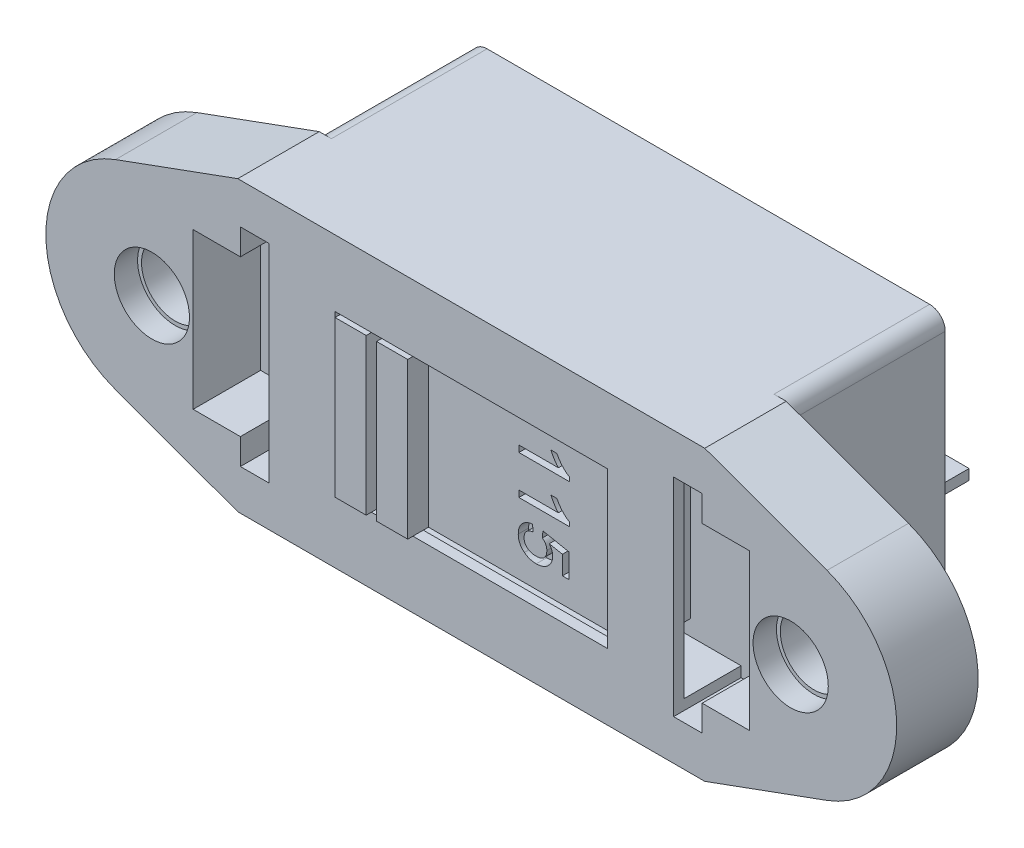
from build123d import *

# Parameters (mm, degrees)
SKETCH1_R           = 1.651
BASE_EXTRUDE_DEPTH  = 3.9878
SKETCH2_R           = 1.8415
CUT_EXTRUDE1_DEPTH  = 1.143
SKETCH3_W           = 13.335
SKETCH3_H           = 7.62
CUT_EXTRUDE2_DEPTH  = 3.302
CUT_EXTRUDE3_REACH  = 33.786
SKETCH4_W           = 0.508
SKETCH4_H           = 9.144
SKETCH4_W_2         = 2.286
BOSS_EXTRUDE1_DEPTH = 7.62
SKETCH6_W           = 21.6662
SKETCH6_H           = 12.5984
CUT_EXTRUDE4_DEPTH  = 1.524
SKETCH7_W           = 17.3355
SKETCH7_H           = 7.62
BOSS_EXTRUDE7_DEPTH = 2.54
SKETCH8_W           = 1.524
SKETCH8_H           = 7.62
BOSS_EXTRUDE8_DEPTH = 1.016
CUT_EXTRUDE5_DEPTH  = 0.508
SKETCH11_W          = 3.81
SKETCH11_H          = 0.508
BOSS_EXTRUDE9_DEPTH = 6.35
CUT_EXTRUDE6_DEPTH  = 1.27


with BuildPart() as part:
    # Sketch1 → Base-Extrude (new body)
    with BuildSketch(Plane.XY):
        with BuildLine():
            Line((-11.43, 7.0612), (11.43, 7.0612))
            Line((11.43, 7.0612), (17.416208357, 4.876815123))
            ThreePointArc((17.416208357, 4.876815123), (20.828, 0), (17.416208357, -4.876815123))
            Line((17.416208357, -4.876815123), (11.43, -7.0612))
            Line((11.43, -7.0612), (-11.43, -7.0612))
            Line((-11.43, -7.0612), (-17.416208357, -4.876815123))
            ThreePointArc((-17.416208357, -4.876815123), (-20.828, 0), (-17.416208357, 4.876815123))
            Line((-17.416208357, 4.876815123), (-11.43, 7.0612))
        make_face()
        with Locations((-15.636644304, 0)):
            Circle(SKETCH1_R, mode=Mode.SUBTRACT)
        with Locations((15.636644304, 0)):
            Circle(SKETCH1_R, mode=Mode.SUBTRACT)
    extrude(amount=BASE_EXTRUDE_DEPTH)

    # Sketch2 → Cut-Extrude1 (cut)
    with BuildSketch(Plane.XY.offset(3.9878)):
        with Locations((15.636644304, 0)):
            Circle(SKETCH2_R)
        with Locations((-15.636644304, 0)):
            Circle(SKETCH2_R)
    extrude(amount=-CUT_EXTRUDE1_DEPTH, mode=Mode.SUBTRACT)

    # Sketch3 → Cut-Extrude2 (cut)
    with BuildSketch(Plane.XY.offset(3.9878)):
        Polygon((-9.906, -5.08), (-9.906, 5.08), (-11.303, 5.08), (-11.303, 3.81), (-13.6144, 3.81), (-13.6144, -3.81), (-11.303, -3.81), (-11.303, -5.08), align=None)
        Polygon((11.303, 5.08), (9.906, 5.08), (9.906, -5.08), (11.303, -5.08), (11.303, -3.81), (13.6144, -3.81), (13.6144, 3.81), (11.303, 3.81), align=None)
        Rectangle(SKETCH3_W, SKETCH3_H)
    extrude(amount=-CUT_EXTRUDE2_DEPTH, mode=Mode.SUBTRACT)

    # Sketch4 → Cut-Extrude3 (cut, up to next)
    with BuildSketch(Plane(origin=(9.906, 0, 0), x_dir=(0, 0, -1), z_dir=(1, 0, 0)), mode=Mode.PRIVATE) as cut_extrude3_sk1:
        with Locations((-0.9398, 0)):
            Rectangle(SKETCH4_W, SKETCH4_H)
    cut_extrude3_tool1 = extrude(cut_extrude3_sk1.sketch, amount=-CUT_EXTRUDE3_REACH, mode=Mode.PRIVATE) & part.part
    # Sketch4 → Cut-Extrude3 (cut, up to next)
    with BuildSketch(Plane(origin=(9.906, 0, 0), x_dir=(0, 0, -1), z_dir=(1, 0, 0)), mode=Mode.PRIVATE) as cut_extrude3_sk2:
        with Locations((-2.3368, 0)):
            Rectangle(SKETCH4_W_2, SKETCH4_H)
    cut_extrude3_tool2 = extrude(cut_extrude3_sk2.sketch, amount=-CUT_EXTRUDE3_REACH, mode=Mode.PRIVATE) & part.part
    add(cut_extrude3_tool1.solids().sort_by_distance((9.906, 0, 0.9398))[0], mode=Mode.SUBTRACT)
    add(cut_extrude3_tool2.solids().sort_by_distance((9.906, 0, 2.3368))[0], mode=Mode.SUBTRACT)

    # Sketch5 → Boss-Extrude1 (add)
    with BuildSketch(Plane(origin=(0, 0, 0), x_dir=(-1, 0, 0), z_dir=(0, 0, -1))):
        with BuildLine():
            Line((-10.8331, -7.0612), (10.8331, -7.0612))
            ThreePointArc((10.8331, -7.0612), (11.371915367, -6.838015367), (11.5951, -6.2992))
            Line((11.5951, -6.2992), (11.5951, 6.2992))
            ThreePointArc((11.5951, 6.2992), (11.371915367, 6.838015367), (10.8331, 7.0612))
            Line((10.8331, 7.0612), (-10.8331, 7.0612))
            ThreePointArc((-10.8331, 7.0612), (-11.371915367, 6.838015367), (-11.5951, 6.2992))
            Line((-11.5951, 6.2992), (-11.5951, -6.2992))
            ThreePointArc((-11.5951, -6.2992), (-11.371915367, -6.838015367), (-10.8331, -7.0612))
        make_face()
    extrude(amount=BOSS_EXTRUDE1_DEPTH)

    # Sketch6 → Cut-Extrude4 (cut)
    with BuildSketch(Plane(origin=(0, 0, -7.62), x_dir=(-1, 0, 0), z_dir=(0, 0, -1))):
        Rectangle(SKETCH6_W, SKETCH6_H)
    extrude(amount=-CUT_EXTRUDE4_DEPTH, mode=Mode.SUBTRACT)

    # Sketch7 → Boss-Extrude7 (add)
    with BuildSketch(Plane(origin=(0, 0, 0.6858), x_dir=(-1, 0, 0), z_dir=(0, 0, -1))):
        with Locations((1.23825, 0)):
            Rectangle(SKETCH7_W, SKETCH7_H)
    extrude(amount=-BOSS_EXTRUDE7_DEPTH)

    # Sketch8 → Boss-Extrude8 (add)
    with BuildSketch(Plane.XY.offset(3.2258)):
        with Locations((-5.6515, 0)):
            Rectangle(SKETCH8_W, SKETCH8_H)
        with Locations((-3.6195, 0)):
            Rectangle(SKETCH8_W, SKETCH8_H)
    extrude(amount=BOSS_EXTRUDE8_DEPTH)

    # Sketch10 → Cut-Extrude5 (cut)
    with BuildSketch(Plane(origin=(3.167997023, 12.095493177, 3.2258), x_dir=(0, -1, 0), z_dir=(0, 0, 1))):
        with BuildLine():
            Line((10.525225774, -1.598826176), (10.207224694, -1.598826176))
            Line((10.207224694, -1.598826176), (10.207224694, 0.33402414))
            add(Edge.make_bspline(
                [(10.207224694, 0.33402414), (10.188914163, 0.316365886), (10.150857733, 0.279665141), (10.086527357, 0.227724422), (10.014726436, 0.175080302), (9.936387351, 0.124457095), (9.856533907, 0.076800804), (9.779365834, 0.033941298), (9.706171485, -0.002328243), (9.657957973, -0.022160572), (9.634822749, -0.031677102)],
                knots=[0, 0, 0, 0, 0.893362401, 1.856755847, 2.901947673, 4.020460078, 5.132200827, 6.168787962, 7.121294059, 8, 8, 8, 8], degree=3))
            Line((9.634822749, -0.031677102), (9.634822749, 0.261480144))
            add(Edge.make_bspline(
                [(9.634822749, 0.261480144), (9.674559887, 0.281944849), (9.752879431, 0.322279571), (9.863528012, 0.391943181), (9.966830365, 0.467461403), (10.061076427, 0.548817515), (10.145562016, 0.631978067), (10.216759249, 0.715890329), (10.276332562, 0.797478443), (10.306221622, 0.854377104), (10.320512578, 0.88158225)],
                knots=[0, 0, 0, 0, 1.141258006, 2.249351951, 3.335817539, 4.406819942, 5.426913362, 6.360259544, 7.215985427, 8, 8, 8, 8], degree=3))
            Line((10.320512578, 0.88158225), (10.525225774, 0.88158225))
            Line((10.525225774, 0.88158225), (10.525225774, -1.598826176))
        make_face()
        with BuildLine():
            Line((12.433232255, -1.598826176), (12.115231175, -1.598826176))
            Line((12.115231175, -1.598826176), (12.115231175, 0.33402414))
            add(Edge.make_bspline(
                [(12.115231175, 0.33402414), (12.096920645, 0.316365886), (12.058864214, 0.279665141), (11.994533838, 0.227724422), (11.922732918, 0.175080302), (11.844393833, 0.124457095), (11.764540388, 0.076800804), (11.687372315, 0.033941298), (11.614177967, -0.002328243), (11.565964454, -0.022160572), (11.54282923, -0.031677102)],
                knots=[0, 0, 0, 0, 0.893362401, 1.856755847, 2.901947673, 4.020460078, 5.132200827, 6.168787962, 7.121294059, 8, 8, 8, 8], degree=3))
            Line((11.54282923, -0.031677102), (11.54282923, 0.261480144))
            add(Edge.make_bspline(
                [(11.54282923, 0.261480144), (11.582566368, 0.281944849), (11.660885912, 0.322279571), (11.771534493, 0.391943181), (11.874836846, 0.467461403), (11.969082908, 0.548817515), (12.053568497, 0.631978067), (12.12476573, 0.715890329), (12.184339044, 0.797478443), (12.214228104, 0.854377104), (12.22851906, 0.88158225)],
                knots=[0, 0, 0, 0, 1.141258006, 2.249351951, 3.335817539, 4.406819942, 5.426913362, 6.360259544, 7.215985427, 8, 8, 8, 8], degree=3))
            Line((12.22851906, 0.88158225), (12.433232255, 0.88158225))
            Line((12.433232255, 0.88158225), (12.433232255, -1.598826176))
        make_face()
        with BuildLine():
            Line((13.228234956, -0.931023907), (13.546236036, -0.899223799))
            add(Edge.make_bspline(
                [(13.546236036, -0.899223799), (13.549384746, -0.917141415), (13.555509476, -0.951993964), (13.567180827, -1.002444062), (13.58233859, -1.049313614), (13.599370005, -1.093008536), (13.619614715, -1.133066809), (13.641550026, -1.170120932), (13.667418242, -1.2028556), (13.694615198, -1.232982866), (13.724465936, -1.259530315), (13.757258492, -1.281910731), (13.792077934, -1.301436289), (13.829348347, -1.317422948), (13.869126855, -1.329124341), (13.910907182, -1.338378133), (13.955227325, -1.343041076), (13.985466657, -1.343957999), (14.000878205, -1.344425311)],
                knots=[0, 0, 0, 0, 1.237781394, 2.407677316, 3.51963579, 4.58689595, 5.594855907, 6.570874, 7.510833816, 8.428091223, 9.330271693, 10.221190844, 11.124215526, 12.043132878, 12.973586933, 13.941700858, 14.950982896, 16, 16, 16, 16], degree=3))
            add(Edge.make_bspline(
                [(14.000878205, -1.344425311), (14.019784722, -1.343968475), (14.05675724, -1.343075112), (14.110545249, -1.335519404), (14.161352381, -1.323060916), (14.208935529, -1.305626188), (14.253852515, -1.283944041), (14.294613245, -1.25586961), (14.333440218, -1.224311175), (14.36783491, -1.186687465), (14.399143744, -1.145727771), (14.426165621, -1.101018523), (14.448914223, -1.053187251), (14.46806606, -1.002243123), (14.482208294, -0.947895116), (14.49261105, -0.890432349), (14.499289203, -0.829818218), (14.499918095, -0.78827248), (14.500239277, -0.7670546)],
                knots=[0, 0, 0, 0, 1.052816602, 2.058828735, 3.018813999, 3.961574988, 4.877590722, 5.788574389, 6.712363302, 7.658909047, 8.620312049, 9.580784896, 10.562948504, 11.56722449, 12.607883026, 13.686460295, 14.818448981, 16, 16, 16, 16], degree=3))
            add(Edge.make_bspline(
                [(14.500239277, -0.7670546), (14.499874226, -0.746834237), (14.499163389, -0.7074605), (14.493176979, -0.650125792), (14.483077199, -0.596213815), (14.470009031, -0.545130366), (14.451996209, -0.497673686), (14.430631988, -0.4531557), (14.404459919, -0.412521209), (14.375341765, -0.374505005), (14.342085158, -0.340425009), (14.304240805, -0.31164877), (14.263293319, -0.286463748), (14.218417975, -0.266040267), (14.169588348, -0.250866388), (14.117289671, -0.239191454), (14.060979266, -0.233050917), (14.022256625, -0.231974417), (14.002368835, -0.231421531)],
                knots=[0, 0, 0, 0, 1.165854935, 2.270189951, 3.319242023, 4.32700288, 5.306253956, 6.24172124, 7.169108591, 8.088047231, 8.999810445, 9.905349262, 10.822648491, 11.767237767, 12.739852311, 13.766490849, 14.852878837, 16, 16, 16, 16], degree=3))
            add(Edge.make_bspline(
                [(14.002368835, -0.231421531), (13.977639333, -0.232144917), (13.930213745, -0.233532208), (13.862068052, -0.245202991), (13.800032561, -0.264055654), (13.744809634, -0.292153255), (13.695470678, -0.325720455), (13.650990702, -0.363703264), (13.611002924, -0.406076003), (13.589068, -0.437977757), (13.578036144, -0.454022287)],
                knots=[0, 0, 0, 0, 1.182877094, 2.268490576, 3.298955169, 4.273890847, 5.221533034, 6.149304476, 7.069219215, 8, 8, 8, 8], degree=3))
            Line((13.578036144, -0.454022287), (13.260035064, -0.422222179))
            Line((13.260035064, -0.422222179), (13.514435928, 0.849782142))
            Line((13.514435928, 0.849782142), (14.691039925, 0.849782142))
            Line((14.691039925, 0.849782142), (14.691039925, 0.531781062))
            Line((14.691039925, 0.531781062), (13.774302436, 0.531781062))
            Line((13.774302436, 0.531781062), (13.648095757, -0.110680496))
            add(Edge.make_bspline(
                [(13.648095757, -0.110680496), (13.665642205, -0.097513395), (13.700100653, -0.071655293), (13.753849656, -0.037797516), (13.808367213, -0.009257667), (13.863335964, 0.014114068), (13.919192549, 0.032320609), (13.975599904, 0.044969673), (14.032750086, 0.053518655), (14.071072654, 0.054357981), (14.090316009, 0.054779441)],
                knots=[0, 0, 0, 0, 1.093835215, 2.148119334, 3.164235237, 4.159999629, 5.123971815, 6.089888814, 7.040853737, 8, 8, 8, 8], degree=3))
            add(Edge.make_bspline(
                [(14.090316009, 0.054779441), (14.115359931, 0.054123271), (14.164677488, 0.052831112), (14.237348615, 0.042214398), (14.306834437, 0.024191822), (14.373679996, -8.196e-05), (14.437003853, -0.032261005), (14.497447435, -0.071222996), (14.55476671, -0.117289085), (14.608637635, -0.1695901), (14.657500706, -0.227649726), (14.70123475, -0.289574426), (14.736954328, -0.356603763), (14.766996945, -0.426987589), (14.78965573, -0.501881281), (14.806854538, -0.580221944), (14.81605017, -0.662989015), (14.817498868, -0.719334124), (14.818240357, -0.748173286)],
                knots=[0, 0, 0, 0, 0.991958705, 1.953407265, 2.902004973, 3.832128134, 4.765371166, 5.71007953, 6.676509202, 7.674246545, 8.68000108, 9.679398714, 10.671856529, 11.683459888, 12.706765812, 13.76733029, 14.85725088, 16, 16, 16, 16], degree=3))
            add(Edge.make_bspline(
                [(14.818240357, -0.748173286), (14.817677305, -0.775690588), (14.816565118, -0.830045111), (14.807450512, -0.910146548), (14.792436366, -0.987330588), (14.772336567, -1.061825796), (14.745179042, -1.133209096), (14.712239505, -1.201711064), (14.674241902, -1.268046493), (14.643769797, -1.308938456), (14.628433462, -1.329519011)],
                knots=[0, 0, 0, 0, 1.059692978, 2.093196008, 3.100373587, 4.086253034, 5.061402885, 6.037282833, 7.012182238, 8, 8, 8, 8], degree=3))
            add(Edge.make_bspline(
                [(14.628433462, -1.329519011), (14.608949079, -1.353542995), (14.570621205, -1.400800751), (14.50425691, -1.462138491), (14.432914352, -1.514267127), (14.356168963, -1.556617867), (14.27453596, -1.590650272), (14.187012502, -1.61329756), (14.094656162, -1.628506111), (14.031251742, -1.629909835), (13.998890698, -1.630626284)],
                knots=[0, 0, 0, 0, 1.023140956, 2.012628108, 2.982342558, 3.942221589, 4.908720554, 5.902469194, 6.929439212, 8, 8, 8, 8], degree=3))
            add(Edge.make_bspline(
                [(13.998890698, -1.630626284), (13.972197972, -1.630084826), (13.919981641, -1.629025626), (13.843527641, -1.619817445), (13.770810847, -1.605133643), (13.701808477, -1.584072526), (13.636312646, -1.557459833), (13.575084657, -1.523652587), (13.517061964, -1.484979204), (13.463520874, -1.440248164), (13.41473797, -1.390355857), (13.371027497, -1.336359394), (13.332980977, -1.278223565), (13.300616774, -1.216296243), (13.273642704, -1.150636817), (13.253006475, -1.080797137), (13.236660864, -1.007462438), (13.231073041, -0.956770576), (13.228234956, -0.931023907)],
                knots=[0, 0, 0, 0, 1.108768375, 2.168973506, 3.19473529, 4.187459816, 5.162590879, 6.12651078, 7.088512529, 8.056012598, 9.019588496, 9.983680353, 10.938070192, 11.90157236, 12.88306954, 13.882379887, 14.924449348, 16, 16, 16, 16], degree=3))
        make_face()
    extrude(amount=-CUT_EXTRUDE5_DEPTH, mode=Mode.SUBTRACT)

    # Sketch11 → Boss-Extrude9 (add)
    with BuildSketch(Plane(origin=(0, 0, -6.096), x_dir=(-1, 0, 0), z_dir=(0, 0, -1))):
        with Locations((-6.0325, -4.0132)):
            Rectangle(SKETCH11_W, SKETCH11_H)
        with Locations((6.0325, -4.0132)):
            Rectangle(SKETCH11_W, SKETCH11_H)
    extrude(amount=BOSS_EXTRUDE9_DEPTH)

    # Sketch12 → Cut-Extrude6 (cut)
    with BuildSketch(Plane(origin=(0, -3.7592, 0), x_dir=(-1, 0, 0), z_dir=(0, 1, 0))):
        with BuildLine():
            Line((-4.1275, -11.049), (-4.1275, -9.779))
            ThreePointArc((-4.1275, -9.779), (-4.7625, -10.414), (-4.1275, -11.049))
        make_face()
        with BuildLine():
            Line((-7.9375, -11.049), (-7.9375, -9.779))
            ThreePointArc((-7.9375, -9.779), (-7.3025, -10.414), (-7.9375, -11.049))
        make_face()
        with BuildLine():
            Line((7.9375, -11.049), (7.9375, -9.779))
            ThreePointArc((7.9375, -9.779), (7.3025, -10.414), (7.9375, -11.049))
        make_face()
        with BuildLine():
            Line((4.1275, -11.049), (4.1275, -9.779))
            ThreePointArc((4.1275, -9.779), (4.7625, -10.414), (4.1275, -11.049))
        make_face()
    extrude(amount=-CUT_EXTRUDE6_DEPTH, mode=Mode.SUBTRACT)


solid = part.part
